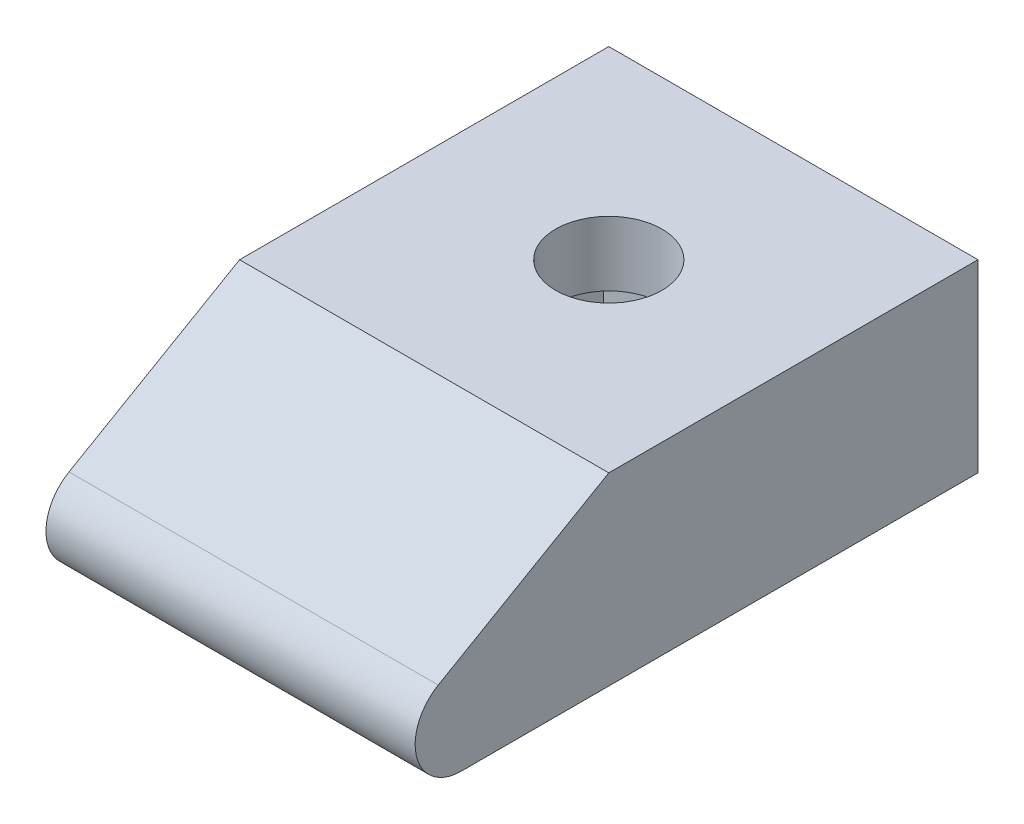
from build123d import *

# Parameters (mm, degrees)
SKETCH1_W           = 25.4
SKETCH1_H           = 25.4
BOSS_EXTRUDE1_DEPTH = 12.7
SKETCH3_R           = 3.6576
CUT_EXTRUDE1_DEPTH  = 4.445
SKETCH2_W           = 13.97
SKETCH2_H           = 13.208
CUT_EXTRUDE2_DEPTH  = 8.255
SKETCH4_W           = 1.27
SKETCH4_H           = 6.985
CUT_EXTRUDE3_DEPTH  = 3.175
BOSS_EXTRUDE2_DEPTH = 25.4
FILLET1_R           = 3.175
SKETCH6_W           = 6.35
SKETCH6_H           = 1.5875
BOSS_EXTRUDE3_DEPTH = 6.35
BOSS_EXTRUDE4_DEPTH = 6.35
SKETCH8_R           = 0.79375
CUT_EXTRUDE4_DEPTH  = 1.5875


with BuildPart() as part:
    # Sketch1 → Boss-Extrude1 (new body)
    with BuildSketch(Plane(origin=(0, 0, 0), x_dir=(1, 0, 0), z_dir=(0, 1, 0))):
        with Locations((12.7, 12.7)):
            Rectangle(SKETCH1_W, SKETCH1_H)
    extrude(amount=BOSS_EXTRUDE1_DEPTH)

    # Sketch3 → Cut-Extrude1 (cut)
    with BuildSketch(Plane(origin=(0, 12.7, 0), x_dir=(1, 0, 0), z_dir=(0, 1, 0))):
        with Locations(Location((12.7, 12.7, 0), (0, 0, 270))):
            Circle(SKETCH3_R)
    extrude(amount=-CUT_EXTRUDE1_DEPTH, mode=Mode.SUBTRACT)

    # Sketch2 → Cut-Extrude2 (cut)
    with BuildSketch(Plane.XZ):
        with Locations((12.7, -12.7)):
            Rectangle(SKETCH2_W, SKETCH2_H)
    extrude(amount=-CUT_EXTRUDE2_DEPTH, mode=Mode.SUBTRACT)

    # Sketch4 → Cut-Extrude3 (cut)
    with BuildSketch(Plane.XZ):
        with Locations((5.08, -12.7)):
            Rectangle(SKETCH4_W, SKETCH4_H)
        with Locations((20.32, -12.7)):
            Rectangle(SKETCH4_W, SKETCH4_H)
    extrude(amount=-CUT_EXTRUDE3_DEPTH, mode=Mode.SUBTRACT)

    # Sketch5 → Boss-Extrude2 (add)
    with BuildSketch(Plane.ZY):
        Polygon((0, 0), (21.997045256, 0), (0, 12.7), align=None)
    extrude(amount=-BOSS_EXTRUDE2_DEPTH)

    # Fillet1
    fillet1_edges = [part.edges().sort_by_distance(p)[0] for p in [
        (12.7, 0, 21.997045256),
    ]]
    fillet(fillet1_edges, radius=FILLET1_R)

    # Sketch6 → Boss-Extrude3 (add)
    with BuildSketch(Plane.XZ):
        with Locations((12.7, -5.30225)):
            Rectangle(SKETCH6_W, SKETCH6_H)
        with Locations((12.7, -20.09775)):
            Rectangle(SKETCH6_W, SKETCH6_H)
    extrude(amount=BOSS_EXTRUDE3_DEPTH)

    # Sketch7 → Boss-Extrude4 (add)
    with BuildSketch(Plane.ZY.offset(-9.525)):
        Polygon((-4.5085, -6.35), (-1.547446371, 0), (-4.5085, 0), align=None)
        Polygon((-20.8915, -6.35), (-23.852553629, 0), (-20.8915, 0), align=None)
    extrude(amount=-BOSS_EXTRUDE4_DEPTH)

    # Sketch8 → Cut-Extrude4 (cut, symmetric)
    with BuildSketch(Plane.ZY.offset(-12.7)):
        with Locations((-19.304, -3.27025)):
            Circle(SKETCH8_R)
        with Locations((-6.096, -3.27025)):
            Circle(SKETCH8_R)
    extrude(amount=CUT_EXTRUDE4_DEPTH, both=True, mode=Mode.SUBTRACT)


solid = part.part
